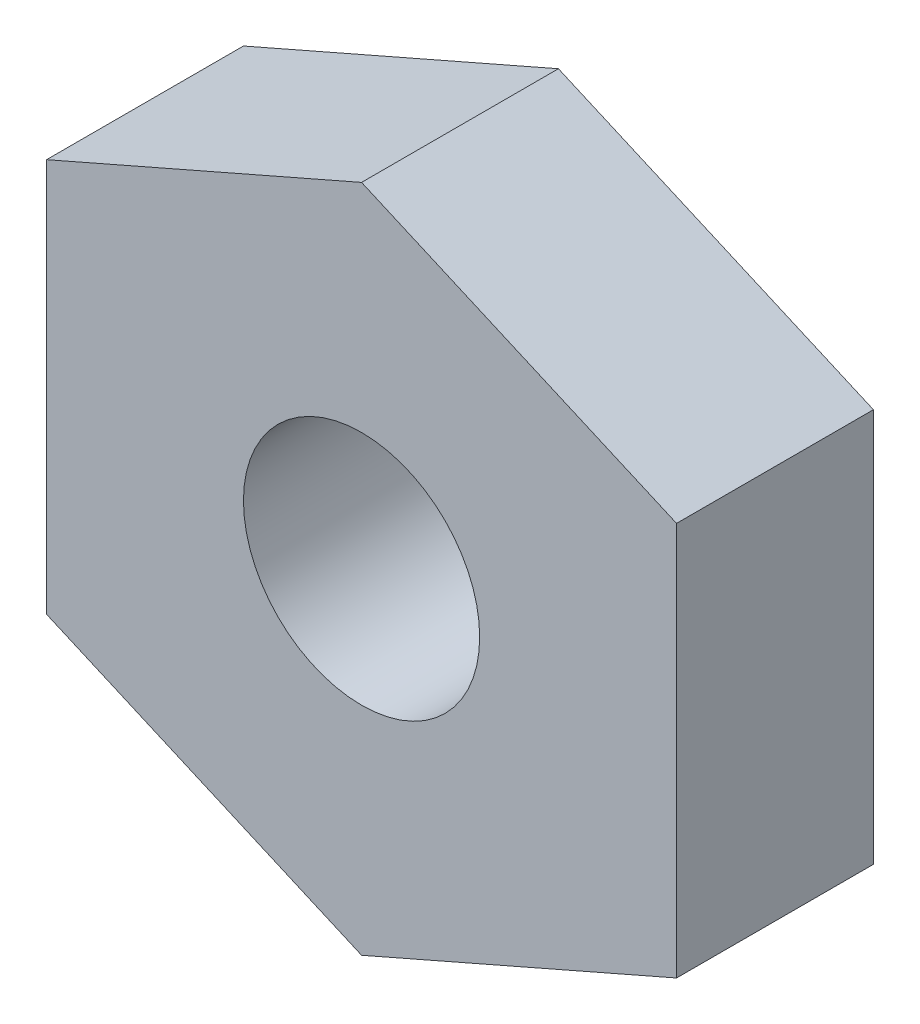
from build123d import *

# Parameters (mm, degrees)
SALIENTE_EXTRUIR1_DEPTH = 2.5
CROQUIS2_R              = 1.5
CORTAR_EXTRUIR2_DEPTH   = 2.5


with BuildPart() as part:
    # Croquis1 → Saliente-Extruir1 (new body)
    with BuildSketch(Plane.XY):
        Polygon((-35.040719462, 0), (-35.040719462, 2.5), (-31.040719462, 4.25), (-27.040719462, 2.5), (-27.040719462, -2.5), (-31.040719462, -4.25), (-35.040719462, -2.5), align=None)
    extrude(amount=SALIENTE_EXTRUIR1_DEPTH)

    # Croquis2 → Cortar-Extruir2 (cut)
    with BuildSketch(Plane.XY.offset(2.5)):
        with Locations((-31.040719462, 0)):
            Circle(CROQUIS2_R)
    extrude(amount=-CORTAR_EXTRUIR2_DEPTH, mode=Mode.SUBTRACT)


solid = part.part
